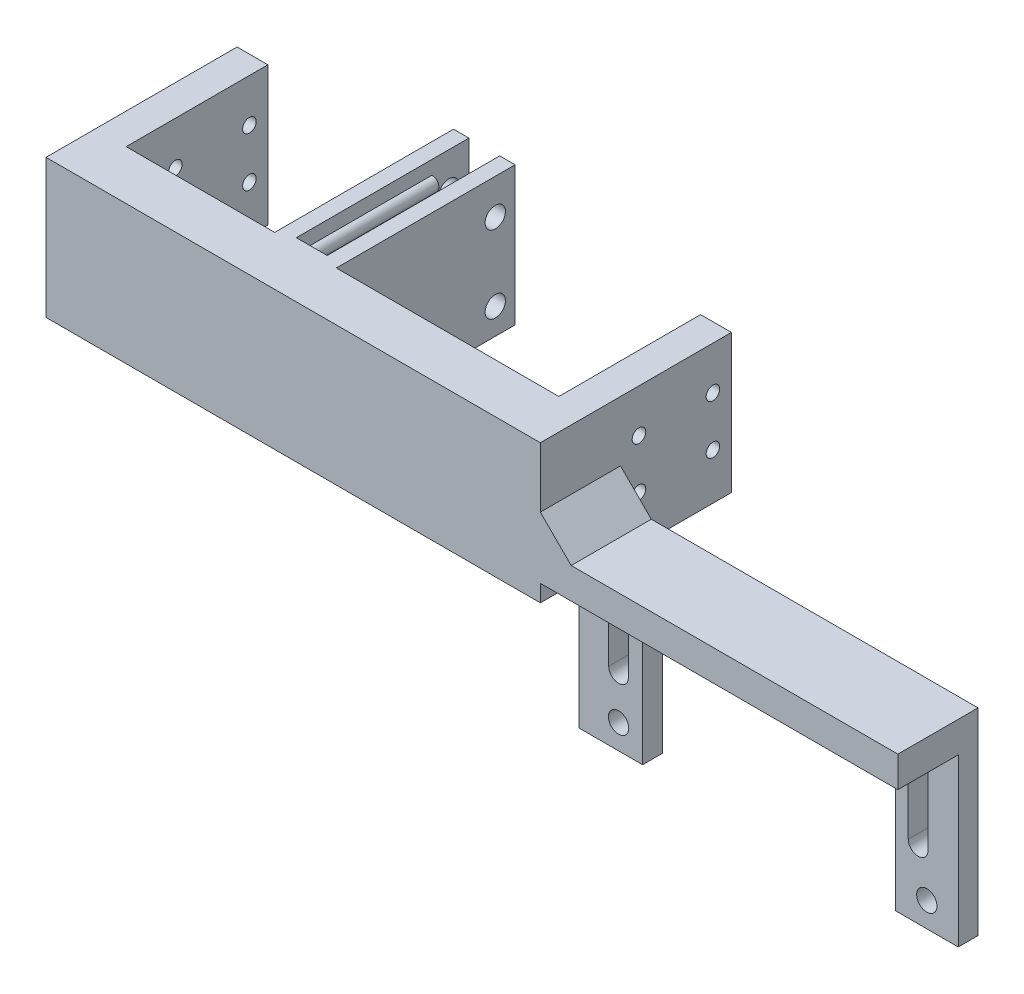
from build123d import *

# Parameters (mm, degrees)
EXTRUDE_1_DEPTH          = 22.5
CUT_EXTRUDE_1_DEPTH      = 55
CUT_EXTRUDE_1_DEPTH_BACK = 117
SKETCH_2_R               = 1.1
SKETCH_5_W               = 13
SKETCH_5_H               = 5
EXTRUDE_4_DEPTH          = 58
CHAMFER_1_SIZE           = 5
SKETCH_6_W               = 10.28735427
SKETCH_6_H               = 3.2
SKETCH_6_W_2             = 10.2120241
EXTRUDE_5_DEPTH          = 27
CUT_EXTRUDE_2_DEPTH      = 27
SKETCH_8_R               = 1.65
CUT_EXTRUDE_3_DEPTH      = 27
SKETCH_11_W              = 10
SKETCH_11_H              = 23.011480114
EXTRUDE_6_DEPTH          = 22.5
SKETCH_12_W              = 5
SKETCH_12_H              = 22.5
CUT_EXTRUDE_5_DEPTH      = 22
EXTRUDE_8_DEPTH          = 22
SKETCH_16_W              = 2.5
SKETCH_16_H              = 22.5
EXTRUDE_9_DEPTH          = 6
SKETCH_17_R              = 1.65
CUT_EXTRUDE_7_DEPTH      = 14


with BuildPart() as part:
    # 草图1 → 凸台-拉伸1 (new body)
    with BuildSketch(Plane(origin=(0, 0, 0), x_dir=(1, 0, 0), z_dir=(0, 1, 0))):
        Polygon((40.1, -19.5), (40.1, 11.5), (35.1, 11.5), (35.1, -11.5), (-35.1, -11.5), (-35.1, 11.5), (-40.1, 11.5), (-40.1, -19.5), align=None)
    extrude(amount=EXTRUDE_1_DEPTH)

    # 草图2 → 切除-拉伸1 (cut, two sides: drawn at the far end of the back side and taken through both)
    with BuildSketch(Plane.ZY.offset(40.1).offset(-CUT_EXTRUDE_1_DEPTH_BACK)):
        with Locations(Location((-8.5, 15.5, 0), (0, 0, 180))):
            Circle(SKETCH_2_R)
        with Locations(Location((3.5, 15.5, 0), (0, 0, 180))):
            Circle(SKETCH_2_R)
        with Locations(Location((3.5, 7.5, 0), (0, 0, 180))):
            Circle(SKETCH_2_R)
        with Locations(Location((-8.5, 7.5, 0), (0, 0, 180))):
            Circle(SKETCH_2_R)
    extrude(amount=CUT_EXTRUDE_1_DEPTH + CUT_EXTRUDE_1_DEPTH_BACK, mode=Mode.SUBTRACT)

    # 草图5 → 凸台-拉伸4 (add)
    with BuildSketch(Plane(origin=(40.1, 0, 0), x_dir=(0, 0, -1), z_dir=(1, 0, 0))):
        with Locations((-13, 5.25)):
            Rectangle(SKETCH_5_W, SKETCH_5_H)
    extrude(amount=EXTRUDE_4_DEPTH)

    # 倒角1
    chamfer_1_edges = [part.edges().sort_by_distance(p)[0] for p in [
        (40.1, 7.75, 13),
    ]]
    chamfer(chamfer_1_edges, length=CHAMFER_1_SIZE)

    # 草图6 → 凸台-拉伸5 (add)
    with BuildSketch(Plane.XZ.offset(-2.75)):
        with Locations((41.744298765, 8.1)):
            Rectangle(SKETCH_6_W, SKETCH_6_H)
        with Locations((92.99398795, 8.1)):
            Rectangle(SKETCH_6_W_2, SKETCH_6_H)
    extrude(amount=EXTRUDE_5_DEPTH)

    # 草图7 → 切除-拉伸2 (cut)
    with BuildSketch(Plane.XY.offset(9.7)):
        with BuildLine():
            Line((89.983046701, -13.162177047), (89.983046701, -0.162177047))
            ThreePointArc((89.983046701, -0.162177047), (91.583046701, 1.437822953), (93.183046701, -0.162177047))
            Line((93.183046701, -0.162177047), (93.183046701, -13.162177047))
            ThreePointArc((93.183046701, -13.162177047), (91.583046701, -14.762177047), (89.983046701, -13.162177047))
        make_face()
        with BuildLine():
            Line((41.3879759, -13.162177047), (41.3879759, -0.162177047))
            ThreePointArc((41.3879759, -0.162177047), (42.9879759, 1.437822953), (44.5879759, -0.162177047))
            Line((44.5879759, -0.162177047), (44.5879759, -13.162177047))
            ThreePointArc((44.5879759, -13.162177047), (42.9879759, -14.762177047), (41.3879759, -13.162177047))
        make_face()
    extrude(amount=-CUT_EXTRUDE_2_DEPTH, mode=Mode.SUBTRACT)

    # 草图8 → 切除-拉伸3 (cut)
    with BuildSketch(Plane.XY.offset(9.7)):
        with Locations((92.99398795, -20.25)):
            Circle(SKETCH_8_R)
        with Locations((42.99398795, -20.25)):
            Circle(SKETCH_8_R)
    extrude(amount=-CUT_EXTRUDE_3_DEPTH, mode=Mode.SUBTRACT)

    # 草图11 → 凸台-拉伸6 (add)
    with BuildSketch(Plane.XZ):
        with Locations((-6, -0.005740057)):
            Rectangle(SKETCH_11_W, SKETCH_11_H)
    extrude(amount=-EXTRUDE_6_DEPTH)

    # 草图12 → 切除-拉伸5 (cut)
    with BuildSketch(Plane(origin=(0, 0, -11.511480114), x_dir=(-1, 0, 0), z_dir=(0, 0, -1))):
        with Locations((6, 11.25)):
            Rectangle(SKETCH_12_W, SKETCH_12_H)
    extrude(amount=-CUT_EXTRUDE_5_DEPTH, mode=Mode.SUBTRACT)

    # 草图14 → 凸台-拉伸8 (add)
    with BuildSketch(Plane(origin=(0, 0, -11.511480114), x_dir=(-1, 0, 0), z_dir=(0, 0, -1))):
        with BuildLine():
            ThreePointArc((8.5, 2.276960614), (7.361519693, 1.138480307), (8.5, 0))
            Line((8.5, 0), (8.5, 2.276960614))
        make_face()
        with BuildLine():
            ThreePointArc((8.5, 5.276960614), (7.361519693, 4.138480307), (8.5, 3))
            Line((8.5, 3), (8.5, 5.276960614))
        make_face()
        with BuildLine():
            ThreePointArc((8.5, 8.276960614), (7.361519693, 7.138480307), (8.5, 6))
            Line((8.5, 6), (8.5, 8.276960614))
        make_face()
        with BuildLine():
            ThreePointArc((8.5, 11.276960614), (7.361519693, 10.138480307), (8.5, 9))
            Line((8.5, 9), (8.5, 11.276960614))
        make_face()
        with BuildLine():
            ThreePointArc((8.5, 17.276960614), (7.361519693, 16.138480307), (8.5, 15))
            Line((8.5, 15), (8.5, 17.276960614))
        make_face()
        with BuildLine():
            ThreePointArc((8.5, 20.276960614), (7.361519693, 19.138480307), (8.5, 18))
            Line((8.5, 18), (8.5, 20.276960614))
        make_face()
        with BuildLine():
            ThreePointArc((8.5, 14.276960614), (7.361519693, 13.138480307), (8.5, 12))
            Line((8.5, 12), (8.5, 14.276960614))
        make_face()
    extrude(amount=-EXTRUDE_8_DEPTH)

    # 草图16 → 凸台-拉伸9 (add)
    with BuildSketch(Plane(origin=(0, 0, -11.511480114), x_dir=(-1, 0, 0), z_dir=(0, 0, -1))):
        with Locations((9.75, 11.25)):
            Rectangle(SKETCH_16_W, SKETCH_16_H)
        with Locations((2.25, 11.25)):
            Rectangle(SKETCH_16_W, SKETCH_16_H)
    extrude(amount=EXTRUDE_9_DEPTH)

    # 草图17 → 切除-拉伸7 (cut)
    with BuildSketch(Plane.ZY.offset(11)):
        with Locations(Location((-14.289107962, 4.226014106, 0), (0, 0, 180))):
            Circle(SKETCH_17_R)
        with Locations(Location((-14.289107962, 16.747856376, 0), (0, 0, 180))):
            Circle(SKETCH_17_R)
    extrude(amount=-CUT_EXTRUDE_7_DEPTH, mode=Mode.SUBTRACT)


solid = part.part
